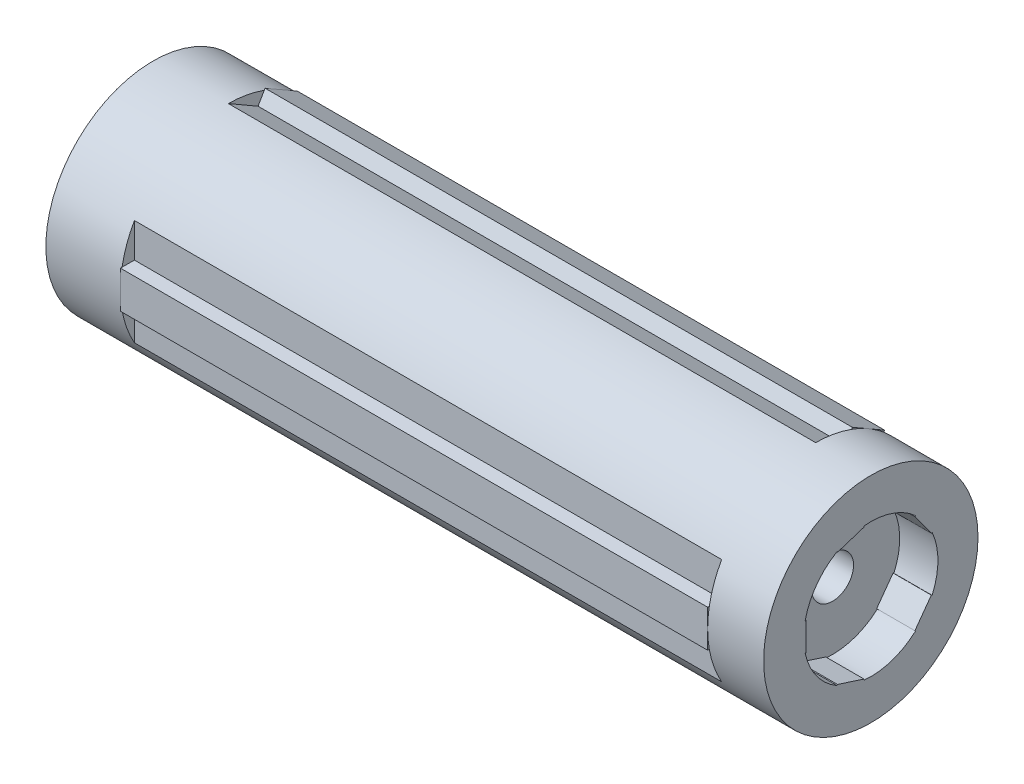
from build123d import *

# Parameters (mm, degrees)
SKIZZE1_R                       = 11.5
AUFSATZ_LINEAR_AUSTRAGEN1_DEPTH = 77
SCHNITT_LINEAR_AUSTRAGEN1_DEPTH = 4.1
SKIZZE3_R                       = 2.25
SCHNITT_LINEAR_AUSTRAGEN2_DEPTH = 3
SKIZZE4_R                       = 9.6
SCHNITT_LINEAR_AUSTRAGEN3_DEPTH = 12.75
SCHNITT_LINEAR_START            = -6
SKIZZE7_W                       = 1.5
SKIZZE7_H                       = 15
SCHNITT_LINEAR_AUSTRAGEN4_DEPTH = 63
SKIZZE8_W                       = 63
SKIZZE8_H                       = 4
AUFSATZ_LINEAR_AUSTRAGEN2_DEPTH = 1.5
SCHNITT_LINEAR_AUSTRAGEN6_DEPTH = 13.5
SKIZZE12_R                      = 3.1
SCHNITT_LINEAR_AUSTRAGEN7_DEPTH = 2
KREISMUSTER3_COUNT              = 3
SKIZZE13_R                      = 8.5
SCHNITT_LINEAR_AUSTRAGEN8_DEPTH = 40


with BuildPart() as part:
    # Skizze1 → Aufsatz-Linear austragen1 (new body)
    with BuildSketch(Plane(origin=(0, 0, 0), x_dir=(0, 0, -1), z_dir=(1, 0, 0))):
        Circle(SKIZZE1_R)
    extrude(amount=AUFSATZ_LINEAR_AUSTRAGEN1_DEPTH)

    # Skizze2 → Schnitt-Linear austragen1 (cut)
    with BuildSketch(Plane(origin=(77, 0, 0), x_dir=(0, 0, -1), z_dir=(1, 0, 0))):
        with BuildLine():
            Line((-7.040453047, 1.507322425), (-6.940453047, 1.507322425))
            Line((-6.940453047, 1.507322425), (-6.940453047, -1.492677575))
            Line((-6.940453047, -1.492677575), (-7.043572507, -1.492677575))
            ThreePointArc((-7.043572507, -1.492677575), (-5.829319782, -4.225994662), (-3.609168454, -6.230080503))
            Line((-3.609168454, -6.230080503), (-3.578266755, -6.134974851))
            Line((-3.578266755, -6.134974851), (-0.725097206, -7.062025834))
            Line((-0.725097206, -7.062025834), (-0.756962871, -7.160098268))
            ThreePointArc((-0.756962871, -7.160098268), (2.217800882, -6.849916733), (4.809864271, -5.357723928))
            Line((4.809864271, -5.357723928), (4.728962572, -5.298945403))
            Line((4.728962572, -5.298945403), (6.492318329, -2.87189442))
            Line((6.492318329, -2.87189442), (6.575743724, -2.932506518))
            ThreePointArc((6.575743724, -2.932506518), (7.199996108, -0.007486699), (6.581828055, 2.918825013))
            Line((6.581828055, 2.918825013), (6.500926356, 2.860046487))
            Line((6.500926356, 2.860046487), (4.737570599, 5.28709747))
            Line((4.737570599, 5.28709747), (4.820995994, 5.347709568))
            ThreePointArc((4.820995994, 5.347709568), (2.232041431, 6.845289698), (-0.742070825, 7.161656993))
            Line((-0.742070825, 7.161656993), (-0.711169126, 7.066551342))
            Line((-0.711169126, 7.066551342), (-3.564338674, 6.139500359))
            Line((-3.564338674, 6.139500359), (-3.59620434, 6.237572793))
            ThreePointArc((-3.59620434, 6.237572793), (-5.820518639, 4.238108396), (-7.040453047, 1.507322425))
        make_face()
    extrude(amount=-SCHNITT_LINEAR_AUSTRAGEN1_DEPTH, mode=Mode.SUBTRACT)

    # Skizze3 → Schnitt-Linear austragen2 (cut)
    with BuildSketch(Plane(origin=(72.9, 0, 0), x_dir=(0, 0, -1), z_dir=(1, 0, 0))):
        Circle(SKIZZE3_R)
    extrude(amount=-SCHNITT_LINEAR_AUSTRAGEN2_DEPTH, mode=Mode.SUBTRACT)

    # Skizze4 → Schnitt-Linear austragen3 (cut)
    with BuildSketch(Plane.ZY):
        Circle(SKIZZE4_R)
    extrude(amount=-SCHNITT_LINEAR_AUSTRAGEN3_DEPTH, mode=Mode.SUBTRACT)

    # Skizze7 → Schnitt-Linear austragen4 (cut)
    with BuildSketch(Plane(origin=(77, 0, 0), x_dir=(0, 0, -1), z_dir=(1, 0, 0)).offset(SCHNITT_LINEAR_START)):
        with Locations((-10.75, 0)):
            Rectangle(SKIZZE7_W, SKIZZE7_H)
    schnitt_linear_austragen4 = extrude(amount=-SCHNITT_LINEAR_AUSTRAGEN4_DEPTH, mode=Mode.SUBTRACT)

    # Skizze8 → Aufsatz-Linear austragen2 (add)
    with BuildSketch(Plane.XY.offset(10)):
        with Locations((39.5, 0)):
            Rectangle(SKIZZE8_W, SKIZZE8_H)
    aufsatz_linear_austragen2 = extrude(amount=AUFSATZ_LINEAR_AUSTRAGEN2_DEPTH)

    # Skizze10 → Schnitt-Linear austragen6 (cut)
    with BuildSketch(Plane.ZY.offset(-12.75)):
        Polygon((4.139835299, -2.29675794), (4.058968371, 2.436823566), (-0.080866927, 4.733581506), (-4.139835299, 2.29675794), (-4.058968371, -2.436823566), (0.080866927, -4.733581506), align=None)
    extrude(amount=-SCHNITT_LINEAR_AUSTRAGEN6_DEPTH, mode=Mode.SUBTRACT)

    # Skizze12 → Schnitt-Linear austragen7 (cut)
    with BuildSketch(Plane.ZY.offset(-26.25)):
        Circle(SKIZZE12_R)
    extrude(amount=-SCHNITT_LINEAR_AUSTRAGEN7_DEPTH, mode=Mode.SUBTRACT)

    # Kreismuster3: Schnitt-Linear austragen4, Aufsatz-Linear austragen2 ×3 about axis
    kreismuster3_axis = Axis((0, 0, 0), (1, 0, 0))
    add([schnitt_linear_austragen4.rotate(kreismuster3_axis, i * 360 / KREISMUSTER3_COUNT) for i in range(1, KREISMUSTER3_COUNT)], mode=Mode.SUBTRACT)
    add([aufsatz_linear_austragen2.rotate(kreismuster3_axis, i * 360 / KREISMUSTER3_COUNT) for i in range(1, KREISMUSTER3_COUNT)])

    # Skizze13 → Schnitt-Linear austragen8 (cut)
    with BuildSketch(Plane(origin=(69.9, 0, 0), x_dir=(0, 0, -1), z_dir=(1, 0, 0))):
        Circle(SKIZZE13_R)
    extrude(amount=-SCHNITT_LINEAR_AUSTRAGEN8_DEPTH, mode=Mode.SUBTRACT)


solid = part.part
